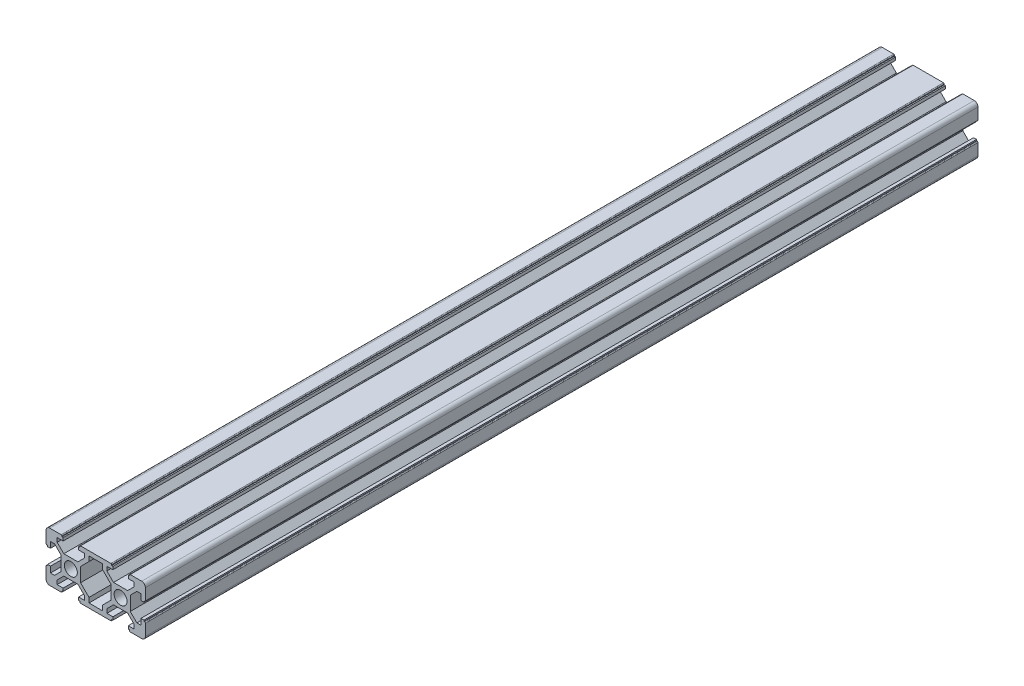
from build123d import *

# Parameters (mm, degrees)
SKETCH_1_R      = 2.6
EXTRUDE_1_DEPTH = 167.5
FILLET_1_R      = 1.5
FILLET_2_R      = 0.3


with BuildPart() as part:
    # 草图1 → 凸台-拉伸1 (new, symmetric)
    with BuildSketch(Plane.XY):
        Polygon((-13.9, 0), (-13.9, 2.839339828), (-16.560660172, 5.5), (-18.2, 5.5), (-18.2, 3.1), (-19.4, 3.1), (-19.4, 3.6), (-20, 3.6), (-20, 10), (-13.6, 10), (-13.6, 9.4), (-13.1, 9.4), (-13.1, 8.2), (-15.5, 8.2), (-15.5, 6.560660172), (-12.839339828, 3.9), (-7.160660172, 3.9), (-4.5, 6.560660172), (-4.5, 8.2), (-6.9, 8.2), (-6.9, 9.4), (-6.4, 9.4), (-6.4, 10), (6.4, 10), (6.4, 9.4), (6.9, 9.4), (6.9, 8.2), (4.5, 8.2), (4.5, 6.560660172), (7.160660172, 3.9), (12.839339828, 3.9), (15.5, 6.560660172), (15.5, 8.2), (13.1, 8.2), (13.1, 9.4), (13.6, 9.4), (13.6, 10), (20, 10), (20, 3.6), (19.4, 3.6), (19.4, 3.1), (18.2, 3.1), (18.2, 5.5), (16.560660172, 5.5), (13.9, 2.839339828), (13.9, 0), (13.9, -2.839339828), (16.560660172, -5.5), (18.2, -5.5), (18.2, -3.1), (19.4, -3.1), (19.4, -3.6), (20, -3.6), (20, -10), (13.6, -10), (13.6, -9.4), (13.1, -9.4), (13.1, -8.2), (15.5, -8.2), (15.5, -6.560660172), (12.839339828, -3.9), (7.160660172, -3.9), (4.5, -6.560660172), (4.5, -8.2), (6.9, -8.2), (6.9, -9.4), (6.4, -9.4), (6.4, -10), (-6.4, -10), (-6.4, -9.4), (-6.9, -9.4), (-6.9, -8.2), (-4.5, -8.2), (-4.5, -6.560660172), (-7.160660172, -3.9), (-12.839339828, -3.9), (-15.5, -6.560660172), (-15.5, -8.2), (-13.1, -8.2), (-13.1, -9.4), (-13.6, -9.4), (-13.6, -10), (-20, -10), (-20, -3.6), (-19.4, -3.6), (-19.4, -3.1), (-18.2, -3.1), (-18.2, -5.5), (-16.560660172, -5.5), (-13.9, -2.839339828), align=None)
        with Locations((-10, 0)):
            Circle(SKETCH_1_R, mode=Mode.SUBTRACT)
        with Locations(Location((10, 0, 0), (0, 0, 180))):
            Circle(SKETCH_1_R, mode=Mode.SUBTRACT)
        Polygon((-6.1, -2.839339828), (-6.1, 2.839339828), (-2.7, 6.239339828), (-2.7, 8.2), (2.7, 8.2), (2.7, 6.239339828), (6.1, 2.839339828), (6.1, -2.839339828), (2.7, -6.239339828), (2.7, -8.2), (-2.7, -8.2), (-2.7, -6.239339828), align=None, mode=Mode.SUBTRACT)
    extrude(amount=EXTRUDE_1_DEPTH, both=True)

    # 圆角1
    fillet_1_edges = [part.edges().sort_by_distance(p)[0] for p in [
        (-20, 10, 0),
        (20, 10, 0),
        (20, -10, 0),
        (-20, -10, 0),
    ]]
    fillet(fillet_1_edges, radius=FILLET_1_R)

    # 圆角2
    fillet_2_edges = [part.edges().sort_by_distance(p)[0] for p in [
        (-20, 3.6, 0),
        (-13.6, 10, 0),
        (-6.4, 10, 0),
        (6.4, 10, 0),
        (13.6, 10, 0),
        (20, 3.6, 0),
        (20, -3.6, 0),
        (13.6, -10, 0),
        (6.4, -10, 0),
        (-6.4, -10, 0),
        (-13.6, -10, 0),
        (-20, -3.6, 0),
    ]]
    fillet(fillet_2_edges, radius=FILLET_2_R)


solid = part.part
